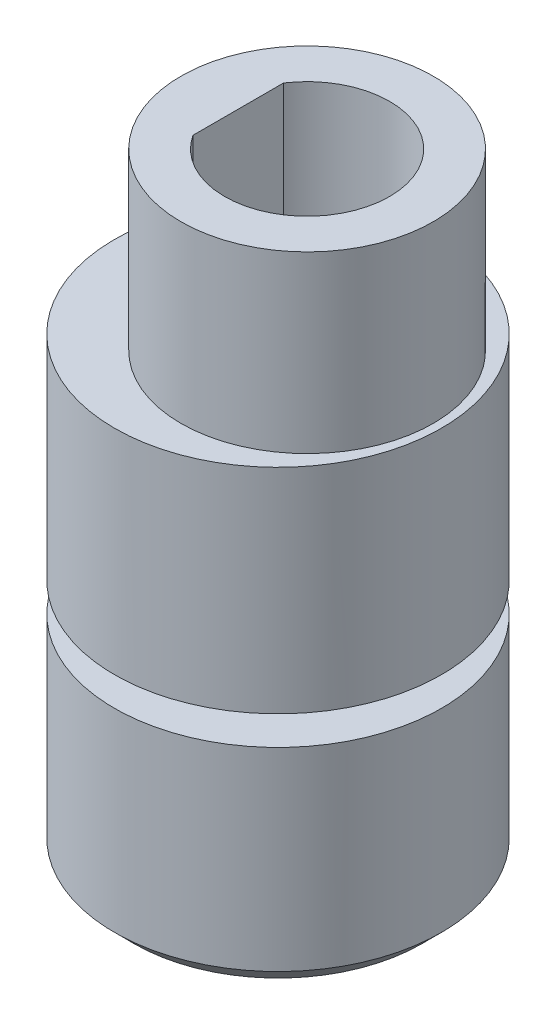
from build123d import *

# Parameters (mm, degrees)
SKETCH1_R           = 8.425
BOSS_EXTRUDE1_DEPTH = 11
SKETCH3_R           = 8.425
BOSS_EXTRUDE2_DEPTH = 11
SKETCH4_R           = 4.25
CUT_EXTRUDE1_DEPTH  = 27.096192251
BOSS_EXTRUDE3_DEPTH = 22
CHAMFER1_SIZE       = 1
SKETCH6_R           = 6.5
BOSS_EXTRUDE4_DEPTH = 9
BOSS_EXTRUDE5_DEPTH = 8
SKETCH10_R          = 1.104065367
CUT_EXTRUDE2_DEPTH  = 35.029564352


with BuildPart() as part:
    # Sketch1 → Boss-Extrude1 (new body)
    with BuildSketch(Plane(origin=(0, 0, 0), x_dir=(1, 0, 0), z_dir=(0, 1, 0))):
        with Locations(Location((0, 0, 0), (0, 0, 270))):
            Circle(SKETCH1_R)
    extrude(amount=BOSS_EXTRUDE1_DEPTH)

    # Sketch3 → Boss-Extrude2 (add)
    with BuildSketch(Plane.XZ):
        with Locations(Location((1.5, 1.5, 0), (0, 0, 142.232408159))):
            Circle(SKETCH3_R)
    extrude(amount=BOSS_EXTRUDE2_DEPTH)

    # Sketch4 → Cut-Extrude1 (cut, through all)
    with BuildSketch(Plane.XZ.offset(11)):
        with Locations(Location((1.5, 0, 0), (0, 0, 270))):
            Circle(SKETCH4_R)
    extrude(amount=-CUT_EXTRUDE1_DEPTH, mode=Mode.SUBTRACT)

    # Sketch5 → Boss-Extrude3 (add)
    with BuildSketch(Plane.XZ.offset(11)):
        with BuildLine():
            Line((-2.05, 2.336664289), (-2.05, -2.336664289))
            ThreePointArc((-2.05, -2.336664289), (-2.75, 0), (-2.05, 2.336664289))
        make_face()
    extrude(amount=-BOSS_EXTRUDE3_DEPTH)

    # Chamfer1
    chamfer1_edges = [part.edges().sort_by_distance(p)[0] for p in [
        (8.159975677, -11, -3.659975677),
    ]]
    chamfer(chamfer1_edges, length=CHAMFER1_SIZE)

    # Sketch6 → Boss-Extrude4 (add)
    with BuildSketch(Plane(origin=(0, 11, 0), x_dir=(1, 0, 0), z_dir=(0, 1, 0))):
        with Locations(Location((1.5, 0, 0), (0, 0, 270))):
            Circle(SKETCH6_R)
        with BuildLine():
            Line((-2.05, 2.336664289), (-2.05, -2.336664289))
            ThreePointArc((-2.05, -2.336664289), (5.75, 0), (-2.05, 2.336664289))
        make_face(mode=Mode.SUBTRACT)
    extrude(amount=BOSS_EXTRUDE4_DEPTH)

    # Sketch7 → Boss-Extrude5 (add)
    with BuildSketch(Plane.XZ.offset(11)):
        with BuildLine():
            Line((-2.05, -2.336664289), (-2.05, 2.336664289))
            ThreePointArc((-2.05, 2.336664289), (5.75, 0), (-2.05, -2.336664289))
        make_face()
    extrude(amount=-BOSS_EXTRUDE5_DEPTH)

    # Sketch10 → Cut-Extrude2 (cut, through all)
    with BuildSketch(Plane.XZ.offset(11)):
        with Locations(Location((1.534537663, 0, 0), (0, 0, 270))):
            Circle(SKETCH10_R)
    extrude(amount=-CUT_EXTRUDE2_DEPTH, mode=Mode.SUBTRACT)


solid = part.part
